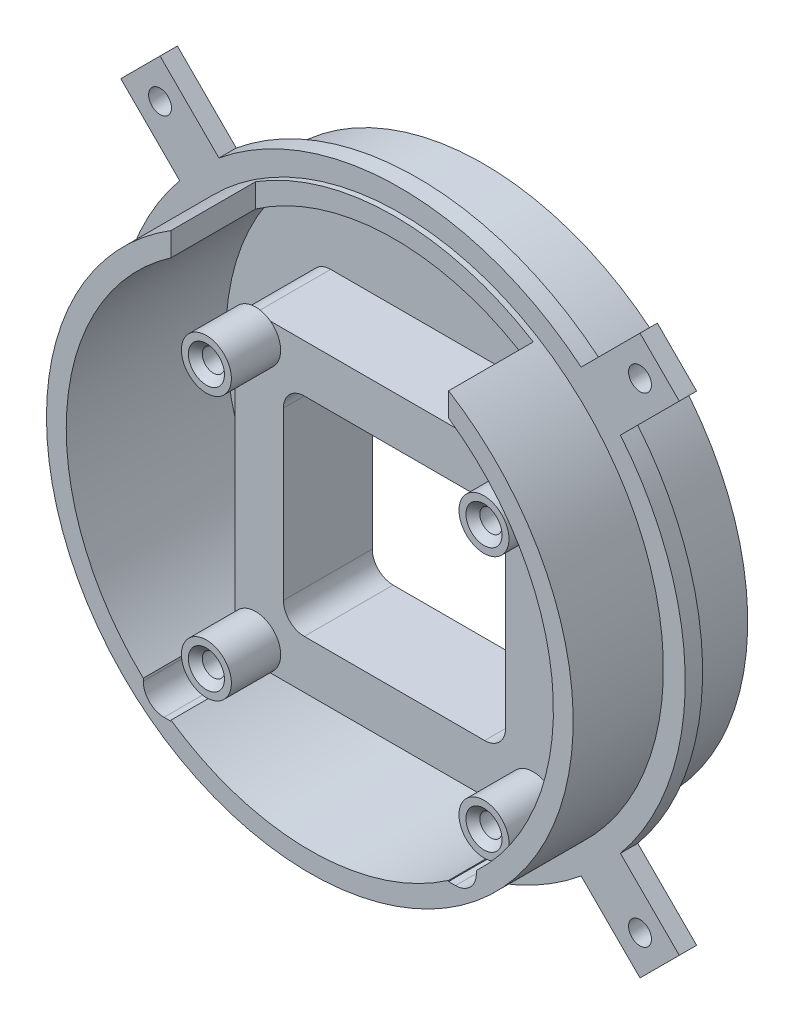
from build123d import *

# Parameters (mm, degrees)
BOSS_EXTRUDE1_DEPTH     = 10.8
CUT_EXTRUDE1_DEPTH      = 63.509359299
CUT_EXTRUDE1_DEPTH_BACK = 63.509359299
SKETCH14_W              = 32
SKETCH14_H              = 30
CUT_EXTRUDE3_DEPTH      = 60.51688836
FILLET1_R               = 3
SKETCH16_R              = 1.6
CUT_EXTRUDE2_DEPTH      = 60.51688836
CUT_EXTRUDE4_DEPTH      = 75.590213715
BOSS_EXTRUDE3_START     = -2.5
SKETCH22_R              = 1.65
BOSS_EXTRUDE3_DEPTH     = 2.5
BOSS_EXTRUDE4_START     = 7.1
SKETCH24_R              = 3.6
SKETCH24_R_2            = 1.6
BOSS_EXTRUDE4_DEPTH     = 7.1
CHAMFER1_SIZE           = 1


with BuildPart() as part:
    # Sketch6 → Revolve1 (revolve)
    with BuildSketch(Plane(origin=(0, 0, 0), x_dir=(0, 0, -1), z_dir=(1, 0, 0)), mode=Mode.PRIVATE) as revolve1_sk:
        Polygon((-2, 25.4), (-2, 35.1), (-25, 35.1), (-25, 37.95), (-12, 37.95), (-12, 41.1), (-9.5, 41.1), (-9.5, 38.1), (0, 38.1), (0, 25.4), (0, 0), (-2, 0), align=None)
    revolve(revolve1_sk.sketch.rotate(Axis((0, 0, 0), (0, 0, 1)), 90), axis=Axis((0, 0, 0), (0, 0, 1)))

    # Sketch15 → Boss-Extrude1 (add)
    with BuildSketch(Plane.XY.offset(2)):
        with BuildLine():
            Line((-20, 15.904297927), (20, 15.904297927))
            ThreePointArc((20, 15.904297927), (22.121320344, 15.02561827), (23, 12.904297927))
            Line((23, 12.904297927), (23, -24.995702073))
            ThreePointArc((23, -24.995702073), (22.121320344, -27.117022417), (20, -27.995702073))
            Line((20, -27.995702073), (-20, -27.995702073))
            ThreePointArc((-20, -27.995702073), (-22.121320344, -27.117022417), (-23, -24.995702073))
            Line((-23, -24.995702073), (-23, 12.904297927))
            ThreePointArc((-23, 12.904297927), (-22.121320344, 15.02561827), (-20, 15.904297927))
        make_face()
    extrude(amount=BOSS_EXTRUDE1_DEPTH)

    # Sketch14 → Cut-Extrude1 (cut, two sides: drawn at the far end of the back side and taken through both)
    with BuildSketch(Plane.XY.offset(2).offset(-CUT_EXTRUDE1_DEPTH_BACK)):
        with Locations((-0.00164643, -5.995702073)):
            Rectangle(SKETCH14_W, SKETCH14_H)
    extrude(amount=CUT_EXTRUDE1_DEPTH + CUT_EXTRUDE1_DEPTH_BACK, mode=Mode.SUBTRACT)

    # Sketch18 → Cut-Extrude3 (cut, through all)
    with BuildSketch(Plane.XY.offset(12.8)):
        with BuildLine():
            Line((19.99835357, -24.995702073), (23.99835357, -24.995702073))
            Line((23.99835357, -24.995702073), (23.99835357, -25.995702073))
            ThreePointArc((23.99835357, -25.995702073), (23.119673914, -28.117022417), (20.99835357, -28.995702073))
            Line((20.99835357, -28.995702073), (19.99835357, -28.995702073))
            Line((19.99835357, -28.995702073), (19.99835357, -24.995702073))
        make_face()
        with BuildLine():
            Line((-20.00164643, -24.995702073), (-24.00164643, -24.995702073))
            Line((-24.00164643, -24.995702073), (-24.00164643, -25.995702073))
            ThreePointArc((-24.00164643, -25.995702073), (-23.122966774, -28.117022417), (-21.00164643, -28.995702073))
            Line((-21.00164643, -28.995702073), (-20.00164643, -28.995702073))
            Line((-20.00164643, -28.995702073), (-20.00164643, -24.995702073))
        make_face()
    extrude(amount=CUT_EXTRUDE3_DEPTH, mode=Mode.SUBTRACT)

    # Fillet1
    fillet1_edges = [part.edges().sort_by_distance(p)[0] for p in [
        (-16.00164643, 9.004297927, 6.4),
        (-16.00164643, -20.995702073, 6.4),
        (15.99835357, -20.995702073, 6.4),
        (15.99835357, 9.004297927, 6.4),
    ]]
    fillet(fillet1_edges, radius=FILLET1_R)

    # Sketch16 → Cut-Extrude2 (cut, through all)
    with BuildSketch(Plane.XY.offset(12.8)):
        with Locations((-20.00164643, 13.004297927)):
            Circle(SKETCH16_R)
        with Locations((-20.00164643, -24.995702073)):
            Circle(SKETCH16_R)
        with Locations((19.99835357, -24.995702073)):
            Circle(SKETCH16_R)
        with Locations((19.99835357, 13.004297927)):
            Circle(SKETCH16_R)
    extrude(amount=-CUT_EXTRUDE2_DEPTH, mode=Mode.SUBTRACT)

    # Sketch20 → Cut-Extrude4 (cut, through all)
    with BuildSketch(Plane(origin=(0, 15.904297927, 0), x_dir=(1, 0, 0), z_dir=(0, 1, 0))):
        Polygon((20, -12.8), (-20, -12.8), (-20, -25), (19.99835357, -25), align=None)
    extrude(amount=CUT_EXTRUDE4_DEPTH, mode=Mode.SUBTRACT)

    # Sketch22 → Boss-Extrude3 (add)
    # profile 1 of 2: a face of its own
    with BuildSketch(Plane.XY.offset(12).offset(BOSS_EXTRUDE3_START)):
        with BuildLine():
            Line((-40.237833378, 34.580979128), (-31.752552003, 26.095697754))
            ThreePointArc((-31.752552003, 26.095697754), (-29.062088707, 29.062088707), (-26.095697754, 31.752552003))
            Line((-26.095697754, 31.752552003), (-34.580979128, 40.237833378))
            Line((-34.580979128, 40.237833378), (-40.237833378, 34.580979128))
        make_face()
        with Locations((-34.580979128, 34.580979128)):
            Circle(SKETCH22_R, mode=Mode.SUBTRACT)
    # profile 2 of 2: a face of its own
    with BuildSketch(Plane.XY.offset(12).offset(BOSS_EXTRUDE3_START)):
        with BuildLine():
            ThreePointArc((26.095697754, 31.752552003), (29.062088707, 29.062088707), (31.752552003, 26.095697754))
            Line((31.752552003, 26.095697754), (40.237833378, 34.580979128))
            Line((40.237833378, 34.580979128), (34.580979128, 40.237833378))
            Line((34.580979128, 40.237833378), (26.095697754, 31.752552003))
        make_face()
        with Locations((34.580979128, 34.580979128)):
            Circle(SKETCH22_R, mode=Mode.SUBTRACT)
    boss_extrude3 = extrude(amount=BOSS_EXTRUDE3_DEPTH)

    # Sketch24 → Boss-Extrude4 (add)
    # profile 1 of 4: a face of its own
    with BuildSketch(Plane.XY.offset(12.8).offset(BOSS_EXTRUDE4_START)):
        with Locations(Location((-20.00164643, 13.004297927, 0), (0, 0, 213.6046846))):
            Circle(SKETCH24_R)
        with Locations((-20.00164643, 13.004297927)):
            Circle(SKETCH24_R_2, mode=Mode.SUBTRACT)
    # profile 2 of 4: a face of its own
    with BuildSketch(Plane.XY.offset(12.8).offset(BOSS_EXTRUDE4_START)):
        with Locations(Location((19.99835357, 13.004297927, 0), (0, 0, 126.336057515))):
            Circle(SKETCH24_R)
        with Locations((19.99835357, 13.004297927)):
            Circle(SKETCH24_R_2, mode=Mode.SUBTRACT)
    # profile 3 of 4: a face of its own
    with BuildSketch(Plane.XY.offset(12.8).offset(BOSS_EXTRUDE4_START)):
        with Locations(Location((-20.00164643, -24.995702073, 0), (0, 0, 198.741091164))):
            Circle(SKETCH24_R)
        with Locations((-20.00164643, -24.995702073)):
            Circle(SKETCH24_R_2, mode=Mode.SUBTRACT)
    # profile 4 of 4: a face of its own
    with BuildSketch(Plane.XY.offset(12.8).offset(BOSS_EXTRUDE4_START)):
        with Locations(Location((19.99835357, -24.995702073, 0), (0, 0, 236.442690237))):
            Circle(SKETCH24_R)
        with Locations((19.99835357, -24.995702073)):
            Circle(SKETCH24_R_2, mode=Mode.SUBTRACT)
    extrude(amount=-BOSS_EXTRUDE4_DEPTH)

    # Chamfer1
    chamfer1_edges = [part.edges().sort_by_distance(p)[0] for p in [
        (-21.60164643, 13.004297927, 19.9),
        (18.39835357, 13.004297927, 19.9),
        (-21.60164643, -24.995702073, 19.9),
        (18.39835357, -24.995702073, 19.9),
    ]]
    chamfer(chamfer1_edges, length=CHAMFER1_SIZE)

    # Mirror1: Boss-Extrude3 across plane
    add(boss_extrude3.mirror(Plane.ZX))


solid = part.part
